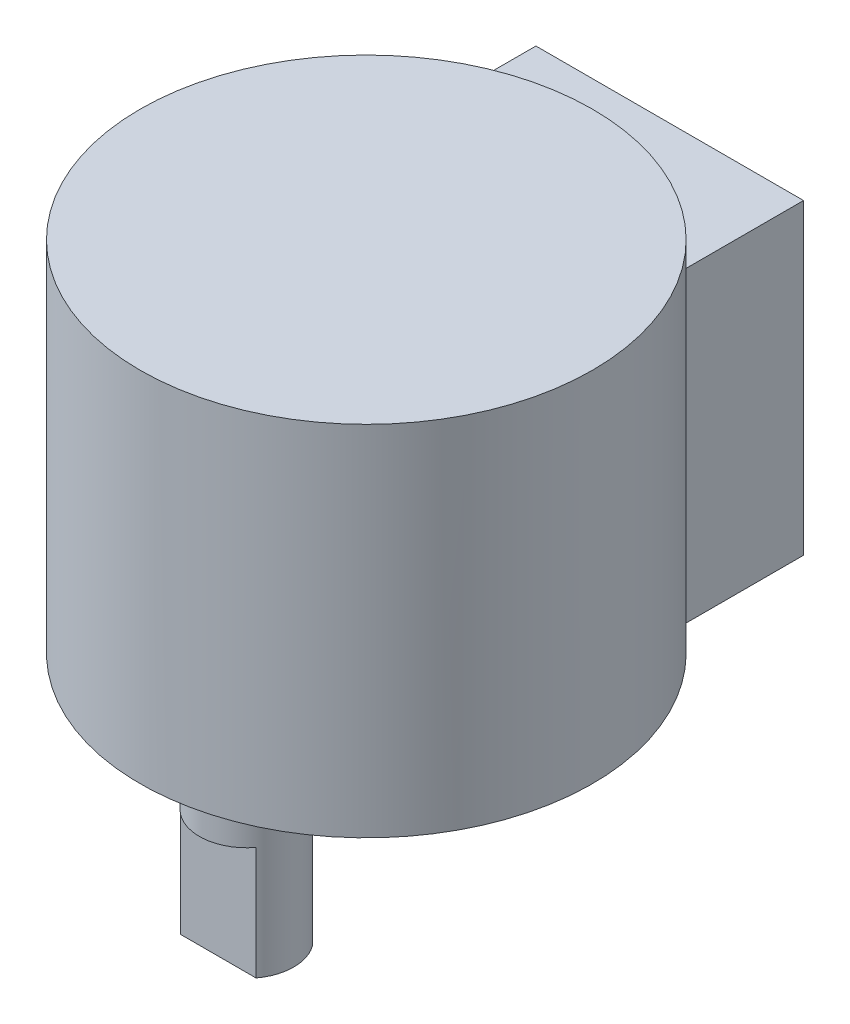
from build123d import *
from build123d.topology import SkipClean

# Parameters (mm, degrees)
SKETCH_1_R      = 12
EXTRUDE_1_DEPTH = 19
SKETCH_2_W      = 14.2
SKETCH_2_H      = 6.425807527
EXTRUDE_2_DEPTH = 16.3
SKETCH_3_R      = 3.5
EXTRUDE_3_DEPTH = 1
SKETCH_4_R      = 2.5
EXTRUDE_4_DEPTH = 3
EXTRUDE_5_DEPTH = 6
SKETCH_6_R      = 0.7
EXTRUDE_6_DEPTH = 2


with BuildPart() as part:
    # 草图1 → 凸台-拉伸1 (new body)
    with BuildSketch(Plane(origin=(0, 0, 0), x_dir=(1, 0, 0), z_dir=(0, 1, 0))):
        with Locations(Location((0, 0, 0), (0, 0, 270))):
            Circle(SKETCH_1_R)
    extrude(amount=EXTRUDE_1_DEPTH)

    # 草图2 → 凸台-拉伸2 (add)
    with BuildSketch(Plane.XZ):
        with Locations((0, -12.887096236)):
            Rectangle(SKETCH_2_W, SKETCH_2_H)
    extrude(amount=-EXTRUDE_2_DEPTH)

    # 草图3 → 凸台-拉伸3 (add)
    with BuildSketch(Plane.XZ):
        with Locations(Location((0, 6.35, 0), (0, 0, 90))):
            Circle(SKETCH_3_R)
    extrude(amount=EXTRUDE_3_DEPTH)

    # 草图4 → 凸台-拉伸4 (add)
    with BuildSketch(Plane.XZ.offset(1)):
        with Locations(Location((0, 6.35, 0), (0, 0, 270))):
            Circle(SKETCH_4_R)
    extrude(amount=EXTRUDE_4_DEPTH)

    # 草图5 → 凸台-拉伸5 (add)
    with SkipClean():  # the faces are left unmerged after this step: merging them gives an invalid solid
        with BuildSketch(Plane.XZ.offset(4)):
            with BuildLine():
                Line((-2, 7.85), (2, 7.85))
                ThreePointArc((2, 7.85), (2.5, 6.35), (2, 4.85))
                Line((2, 4.85), (-2, 4.85))
                ThreePointArc((-2, 4.85), (-2.5, 6.35), (-2, 7.85))
            make_face()
        extrude(amount=EXTRUDE_5_DEPTH)

    # 草图6 → 凸台-拉伸6 (add)
    with SkipClean():  # the faces are left unmerged after this step: merging them gives an invalid solid
        with BuildSketch(Plane(origin=(0, 0, -16.1), x_dir=(-1, 0, 0), z_dir=(0, 0, -1))):
            with Locations((-3.6, 2.5)):
                Circle(SKETCH_6_R)
            with Locations((-2.1, 2.5)):
                Circle(SKETCH_6_R)
            with Locations((-0.6, 2.5)):
                Circle(SKETCH_6_R)
            with Locations((0.9, 2.5)):
                Circle(SKETCH_6_R)
            with Locations((2.4, 2.5)):
                Circle(SKETCH_6_R)
            with Locations((3.9, 2.5)):
                Circle(SKETCH_6_R)
        extrude(amount=EXTRUDE_6_DEPTH)


solid = part.part
